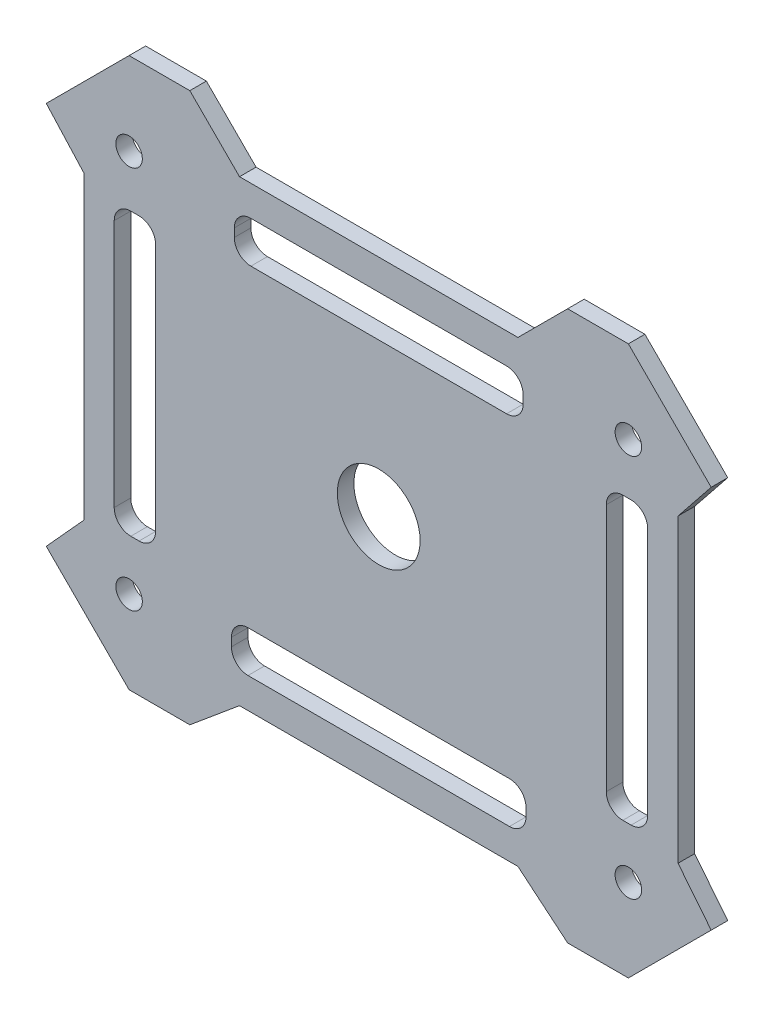
from build123d import *

# Parameters (mm, degrees)
SKETCH1_R           = 7.50000053
SKETCH1_R_2         = 2.40000017
BOSS_EXTRUDE1_DEPTH = 3


with BuildPart() as part:
    # Sketch1 → Boss-Extrude1 (new body)
    with BuildSketch(Plane.XY):
        Polygon((-66.82145848, 56.78846893), (-51.82145848, 71.788469895), (-40.82145848, 71.788469895), (-31.82145848, 62.788469895), (18.60254152, 62.788469895), (27.60254152, 71.788469895), (38.60254152, 71.788469895), (53.60254152, 56.78846893), (47.602540757, 49.288468575), (47.602540757, -5.180529152), (53.60254152, -12.680530105), (38.60254152, -27.680530105), (27.60254152, -27.680530105), (18.60254152, -20.180530996), (-31.82145848, -20.180530996), (-40.82145848, -27.680532227), (-51.82145848, -27.680532227), (-66.82145848, -12.680530105), (-60.014272565, -5.180529152), (-60.014272565, 49.288468575), align=None)
        with Locations((-6.60945848, 22.053969711)):
            Circle(SKETCH1_R, mode=Mode.SUBTRACT)
        with Locations((-51.82145848, 56.788469895)):
            Circle(SKETCH1_R_2, mode=Mode.SUBTRACT)
        with Locations((38.60254152, 56.788469895)):
            Circle(SKETCH1_R_2, mode=Mode.SUBTRACT)
        with Locations((38.60254152, -12.680530105)):
            Circle(SKETCH1_R_2, mode=Mode.SUBTRACT)
        with Locations((-51.82145848, -12.680530105)):
            Circle(SKETCH1_R_2, mode=Mode.SUBTRACT)
        with BuildLine():
            Line((-51.514272883, 47.553971515), (-50.014272777, 47.553971515))
            ThreePointArc((-50.014272777, 47.553971515), (-47.892952283, 46.675291796), (-47.014272565, 44.553971302))
            Line((-47.014272565, 44.553971302), (-47.014272565, -0.44603188))
            ThreePointArc((-47.014272565, -0.44603188), (-47.892952283, -2.567352373), (-50.014272777, -3.446032092))
            Line((-50.014272777, -3.446032092), (-51.514272883, -3.446032092))
            ThreePointArc((-51.514272883, -3.446032092), (-53.635593376, -2.567352373), (-54.514273095, -0.44603188))
            Line((-54.514273095, -0.44603188), (-54.514273095, 44.553971302))
            ThreePointArc((-54.514273095, 44.553971302), (-53.635593376, 46.675291796), (-51.514272883, 47.553971515))
        make_face(mode=Mode.SUBTRACT)
        with BuildLine():
            Line((-29.764949317, 57.288470425), (16.546032357, 57.288470425))
            ThreePointArc((16.546032357, 57.288470425), (18.66735285, 56.409790707), (19.546032569, 54.288470213))
            Line((19.546032569, 54.288470213), (19.546032569, 52.788470107))
            ThreePointArc((19.546032569, 52.788470107), (18.66735285, 50.667149613), (16.546032357, 49.788469895))
            Line((16.546032357, 49.788469895), (-29.764949317, 49.788469895))
            ThreePointArc((-29.764949317, 49.788469895), (-31.886269811, 50.667149613), (-32.764949529, 52.788470107))
            Line((-32.764949529, 52.788470107), (-32.764949529, 54.288470213))
            ThreePointArc((-32.764949529, 54.288470213), (-31.886269811, 56.409790707), (-29.764949317, 57.288470425))
        make_face(mode=Mode.SUBTRACT)
        with BuildLine():
            Line((39.102541076, 47.553971515), (37.60254097, 47.553971515))
            ThreePointArc((37.60254097, 47.553971515), (35.481220476, 46.675291796), (34.602540757, 44.553971302))
            Line((34.602540757, 44.553971302), (34.602540757, -0.44603188))
            ThreePointArc((34.602540757, -0.44603188), (35.481220476, -2.567352373), (37.60254097, -3.446032092))
            Line((37.60254097, -3.446032092), (39.102541076, -3.446032092))
            ThreePointArc((39.102541076, -3.446032092), (41.223861569, -2.567352373), (42.102541288, -0.44603188))
            Line((42.102541288, -0.44603188), (42.102541288, 44.553971302))
            ThreePointArc((42.102541288, 44.553971302), (41.223861569, 46.675291796), (39.102541076, 47.553971515))
        make_face(mode=Mode.SUBTRACT)
        with BuildLine():
            Line((17.068043194, -14.680531527), (-30.286960155, -14.680531527))
            ThreePointArc((-30.286960155, -14.680531527), (-32.408280648, -13.801851808), (-33.286960367, -11.680531315))
            Line((-33.286960367, -11.680531315), (-33.286960367, -10.180531209))
            ThreePointArc((-33.286960367, -10.180531209), (-32.408280648, -8.059210715), (-30.286960155, -7.180530996))
            Line((-30.286960155, -7.180530996), (17.068043194, -7.180530996))
            ThreePointArc((17.068043194, -7.180530996), (19.189363688, -8.059210715), (20.068043406, -10.180531209))
            Line((20.068043406, -10.180531209), (20.068043406, -11.680531315))
            ThreePointArc((20.068043406, -11.680531315), (19.189363688, -13.801851808), (17.068043194, -14.680531527))
        make_face(mode=Mode.SUBTRACT)
    extrude(amount=BOSS_EXTRUDE1_DEPTH)


solid = part.part
